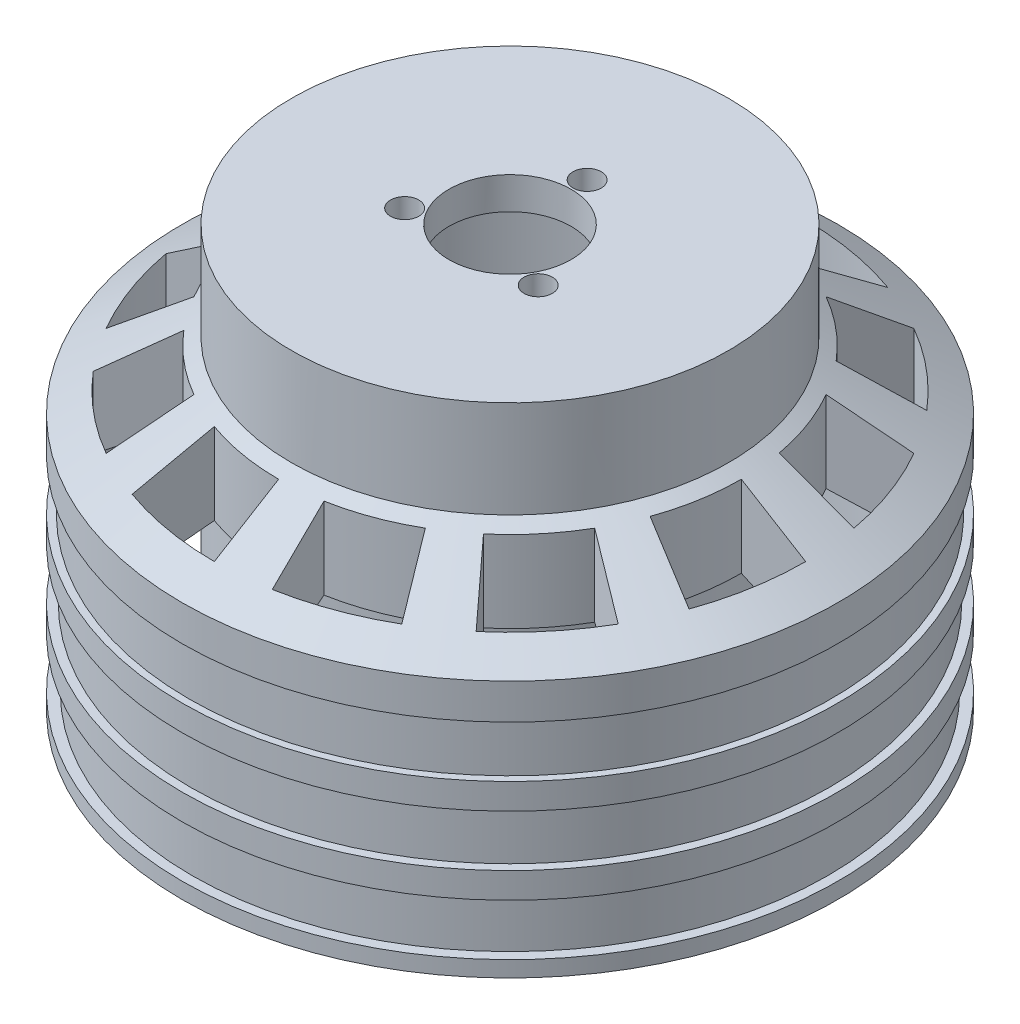
from build123d import *

# Parameters (mm, degrees)
SKETCH_2_R          = 4.75
SKETCH_2_R_2        = 1.1
CUT_EXTRUDE_1_DEPTH = 10
CUT_EXTRUDE_2_DEPTH = 17.5
SKETCH_9_R          = 26
SKETCH_9_R_2        = 24.954284739
CUT_EXTRUDE_4_DEPTH = 4
SKETCH_10_R         = 27.155658861
SKETCH_10_R_2       = 24.851094357
CUT_EXTRUDE_5_DEPTH = 4
SKETCH_11_R         = 26.970973613
SKETCH_11_R_2       = 24.736173034
CUT_EXTRUDE_6_DEPTH = 4


with BuildPart() as part:
    # 草图1 → 旋转1 (revolve)
    with BuildSketch(Plane.XY, mode=Mode.PRIVATE) as revolve_1_sk:
        Polygon((0, 2.5), (17, 2.5), (17, -24), (14, -24), (14, 0), (0, 0), align=None)
    revolve(revolve_1_sk.sketch.rotate(Axis((0, 0, 0), (0, 1, 0)), 90), axis=Axis((0, 0, 0), (0, 1, 0)))

    # 草图2 → 切除-拉伸1 (cut)
    with BuildSketch(Plane(origin=(0, 2.5, 0), x_dir=(1, 0, 0), z_dir=(0, 1, 0))):
        with Locations(Location((0, 0, 0), (0, 0, 270))):
            Circle(SKETCH_2_R)
        with Locations(Location((0, 6, 0), (0, 0, 270))):
            Circle(SKETCH_2_R_2)
        with Locations(Location((5.196152423, -3, 0), (0, 0, 270))):
            Circle(SKETCH_2_R_2)
        with Locations(Location((-5.196152423, -3, 0), (0, 0, 270))):
            Circle(SKETCH_2_R_2)
    extrude(amount=-CUT_EXTRUDE_1_DEPTH, mode=Mode.SUBTRACT)

    # 草图6 → 旋转3 (revolve)
    with BuildSketch(Plane(origin=(0, 0, 0), x_dir=(0, 0, -1), z_dir=(1, 0, 0)), mode=Mode.PRIVATE) as revolve_3_sk:
        Polygon((17, -11.545676787), (17, -5.056486478), (25.5, -10.238041423), (25.5, -30.238041423), (22.594733801, -28.353869151), (22.594733801, -14.08803646), align=None)
    revolve(revolve_3_sk.sketch.rotate(Axis((0, 0, 0), (0, -1, 0)), 180), axis=Axis((0, 0, 0), (0, -1, 0)))

    # 草图7 → 切除-拉伸2 (cut, symmetric)
    with BuildSketch(Plane(origin=(0, 0, 0), x_dir=(1, 0, 0), z_dir=(0, 1, 0))):
        with BuildLine():
            Line((0, 23), (0, 18))
            ThreePointArc((0, 18), (3.070781712, 17.736129783), (6.051531441, 16.95225552))
            Line((6.051531441, 16.95225552), (7.732512397, 21.661215387))
            ThreePointArc((7.732512397, 21.661215387), (3.923776632, 22.6628325), (0, 23))
        make_face()
        with BuildLine():
            Line((17.527159865, 14.892906603), (13.71690772, 11.655318211))
            ThreePointArc((13.71690772, 11.655318211), (11.527439863, 13.824548101), (9, 15.588457268))
            Line((9, 15.588457268), (11.5, 19.918584287))
            ThreePointArc((11.5, 19.918584287), (14.729506492, 17.664700351), (17.527159865, 14.892906603))
        make_face()
        with BuildLine():
            Line((22.625419, 4.134055522), (17.706849652, 3.2353478))
            ThreePointArc((17.706849652, 3.2353478), (16.895329813, 6.20868992), (15.588457268, 9))
            Line((15.588457268, 9), (19.918584287, 11.5))
            ThreePointArc((19.918584287, 11.5), (21.588476983, 7.933326009), (22.625419, 4.134055522))
        make_face()
        with BuildLine():
            Line((21.661215387, -7.732512397), (16.95225552, -6.051531441))
            ThreePointArc((16.95225552, -6.051531441), (17.736129783, -3.070781712), (18, 0))
            Line((18, 0), (23, 0))
            ThreePointArc((23, 0), (22.6628325, -3.923776632), (21.661215387, -7.732512397))
        make_face()
        with BuildLine():
            Line((14.892906603, -17.527159865), (11.655318211, -13.71690772))
            ThreePointArc((11.655318211, -13.71690772), (13.824548101, -11.527439863), (15.588457268, -9))
            Line((15.588457268, -9), (19.918584287, -11.5))
            ThreePointArc((19.918584287, -11.5), (17.664700351, -14.729506492), (14.892906603, -17.527159865))
        make_face()
        with BuildLine():
            Line((4.134055522, -22.625419), (3.2353478, -17.706849652))
            ThreePointArc((3.2353478, -17.706849652), (6.20868992, -16.895329813), (9, -15.588457268))
            Line((9, -15.588457268), (11.5, -19.918584287))
            ThreePointArc((11.5, -19.918584287), (7.933326009, -21.588476983), (4.134055522, -22.625419))
        make_face()
        with BuildLine():
            Line((-7.732512397, -21.661215387), (-6.051531441, -16.95225552))
            ThreePointArc((-6.051531441, -16.95225552), (-3.070781712, -17.736129783), (0, -18))
            Line((0, -18), (0, -23))
            ThreePointArc((0, -23), (-3.923776632, -22.6628325), (-7.732512397, -21.661215387))
        make_face()
        with BuildLine():
            Line((-17.527159865, -14.892906603), (-13.71690772, -11.655318211))
            ThreePointArc((-13.71690772, -11.655318211), (-11.527439863, -13.824548101), (-9, -15.588457268))
            Line((-9, -15.588457268), (-11.5, -19.918584287))
            ThreePointArc((-11.5, -19.918584287), (-14.729506492, -17.664700351), (-17.527159865, -14.892906603))
        make_face()
        with BuildLine():
            Line((-22.625419, -4.134055522), (-17.706849652, -3.2353478))
            ThreePointArc((-17.706849652, -3.2353478), (-16.895329813, -6.20868992), (-15.588457268, -9))
            Line((-15.588457268, -9), (-19.918584287, -11.5))
            ThreePointArc((-19.918584287, -11.5), (-21.588476983, -7.933326009), (-22.625419, -4.134055522))
        make_face()
        with BuildLine():
            Line((-21.661215387, 7.732512397), (-16.95225552, 6.051531441))
            ThreePointArc((-16.95225552, 6.051531441), (-17.736129783, 3.070781712), (-18, 0))
            Line((-18, 0), (-23, 0))
            ThreePointArc((-23, 0), (-22.6628325, 3.923776632), (-21.661215387, 7.732512397))
        make_face()
        with BuildLine():
            Line((-14.892906603, 17.527159865), (-11.655318211, 13.71690772))
            ThreePointArc((-11.655318211, 13.71690772), (-13.824548101, 11.527439863), (-15.588457268, 9))
            Line((-15.588457268, 9), (-19.918584287, 11.5))
            ThreePointArc((-19.918584287, 11.5), (-17.664700351, 14.729506492), (-14.892906603, 17.527159865))
        make_face()
        with BuildLine():
            Line((-4.134055522, 22.625419), (-3.2353478, 17.706849652))
            ThreePointArc((-3.2353478, 17.706849652), (-6.20868992, 16.895329813), (-9, 15.588457268))
            Line((-9, 15.588457268), (-11.5, 19.918584287))
            ThreePointArc((-11.5, 19.918584287), (-7.933326009, 21.588476983), (-4.134055522, 22.625419))
        make_face()
    extrude(amount=CUT_EXTRUDE_2_DEPTH, both=True, mode=Mode.SUBTRACT)

    # 草图9 → 切除-拉伸4 (cut)
    with BuildSketch(Plane(origin=(0, -13, 0), x_dir=(1, 0, 0), z_dir=(0, 1, 0))):
        Circle(SKETCH_9_R)
        with Locations(Location((0, 0, 0), (0, 0, 270))):
            Circle(SKETCH_9_R_2, mode=Mode.SUBTRACT)
    extrude(amount=-CUT_EXTRUDE_4_DEPTH, mode=Mode.SUBTRACT)

    # 草图10 → 切除-拉伸5 (cut)
    with BuildSketch(Plane(origin=(0, -19, 0), x_dir=(1, 0, 0), z_dir=(0, 1, 0))):
        Circle(SKETCH_10_R)
        with Locations(Location((0, 0, 0), (0, 0, 270))):
            Circle(SKETCH_10_R_2, mode=Mode.SUBTRACT)
    extrude(amount=-CUT_EXTRUDE_5_DEPTH, mode=Mode.SUBTRACT)

    # 草图11 → 切除-拉伸6 (cut)
    with BuildSketch(Plane(origin=(0, -25, 0), x_dir=(1, 0, 0), z_dir=(0, 1, 0))):
        Circle(SKETCH_11_R)
        with Locations(Location((0, 0, 0), (0, 0, 270))):
            Circle(SKETCH_11_R_2, mode=Mode.SUBTRACT)
    extrude(amount=-CUT_EXTRUDE_6_DEPTH, mode=Mode.SUBTRACT)


solid = part.part
